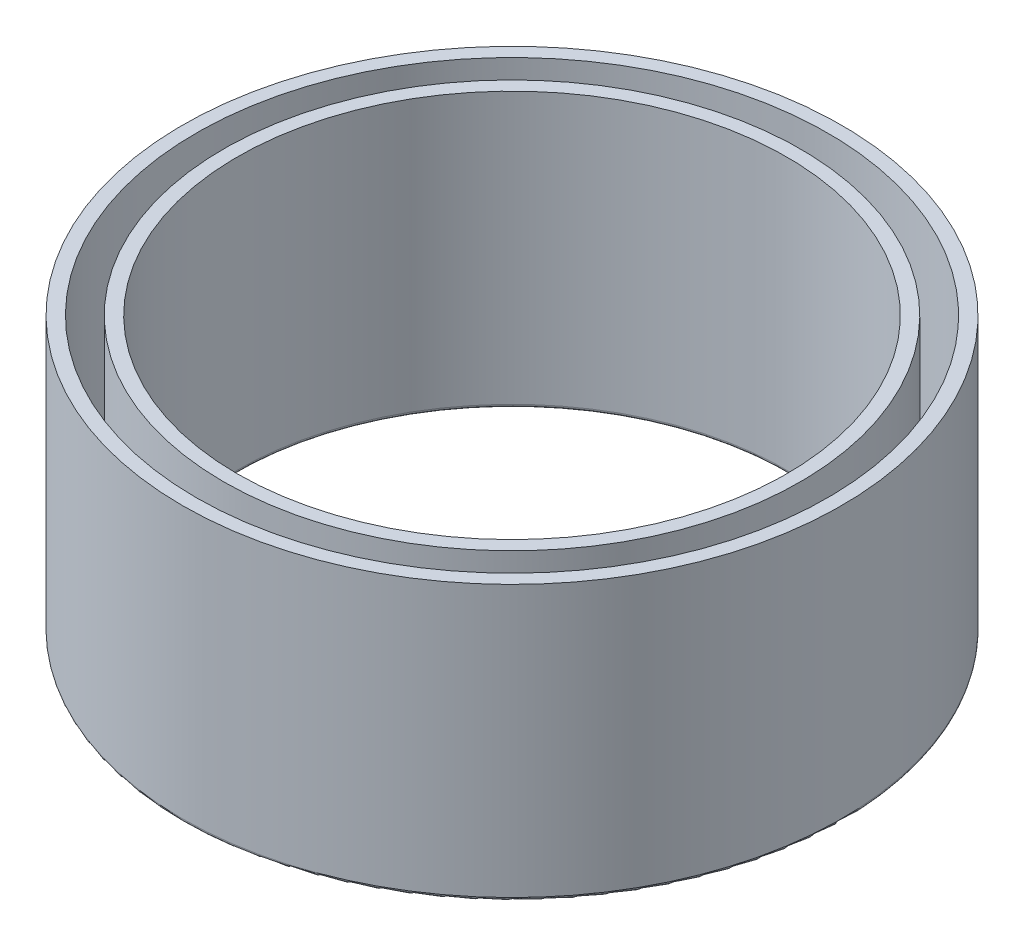
from build123d import *

# Parameters (mm, degrees)
SKETCH1_R           = 24
SKETCH1_R_2         = 20
BOSS_EXTRUDE1_DEPTH = 20
SHELL4_T            = -1
FILLET1_R           = 0.25
FILLET2_R           = 0.25


with BuildPart() as part:
    # Sketch1 → Boss-Extrude1 (new body)
    with BuildSketch(Plane(origin=(0, 0, 0), x_dir=(1, 0, 0), z_dir=(0, 1, 0))):
        with Locations(Location((0, 0, 0), (0, 0, 270))):
            Circle(SKETCH1_R)
        with Locations(Location((0, 0, 0), (0, 0, 270))):
            Circle(SKETCH1_R_2, mode=Mode.SUBTRACT)
    extrude(amount=-BOSS_EXTRUDE1_DEPTH)

    # Shell4
    shell4_openings = [part.faces().sort_by_distance(p)[0] for p in [
        (0, 0, -23.32117749),
    ]]
    offset(amount=SHELL4_T, openings=shell4_openings, kind=Kind.INTERSECTION)

    # Fillet1
    fillet1_edges = [part.edges().sort_by_distance(p)[0] for p in [
        (0, -20, -20),
    ]]
    fillet(fillet1_edges, radius=FILLET1_R)

    # Fillet2
    fillet2_edges = [part.edges().sort_by_distance(p)[0] for p in [
        (0, -20, -24),
    ]]
    fillet(fillet2_edges, radius=FILLET2_R)


solid = part.part
